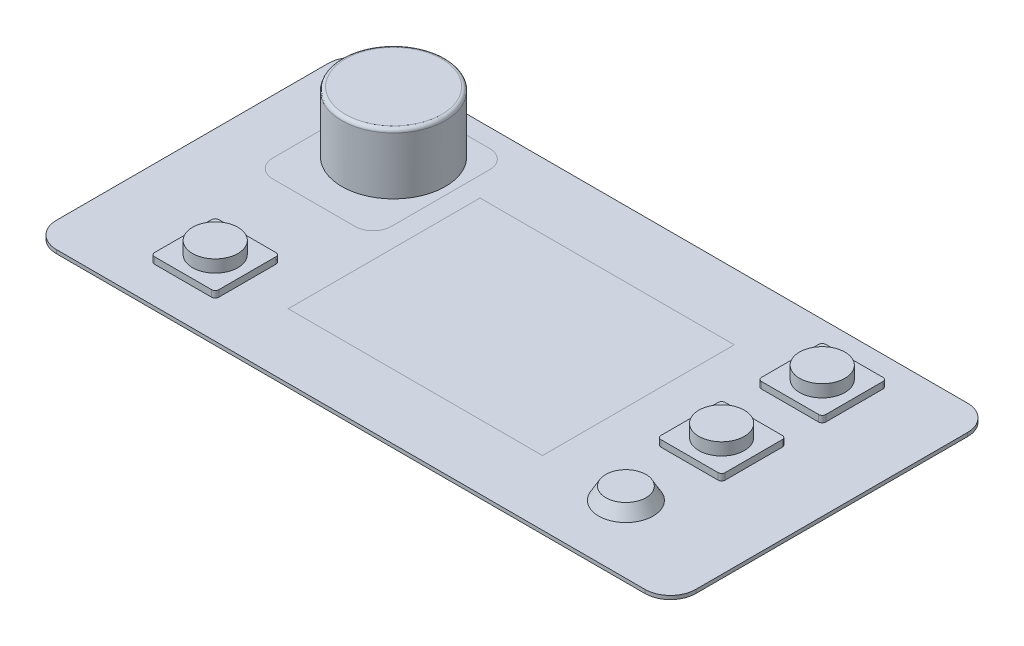
from build123d import *

# Parameters (mm, degrees)
SKETCH1_W           = 176
SKETCH1_H           = 88.8
BOSS_EXTRUDE1_DEPTH = 1
SKETCH2_R           = 14.25
BOSS_EXTRUDE2_DEPTH = 16.7
FILLET1_R           = 1
SKETCH3_W           = 17.7
SKETCH3_H           = 17.7
BOSS_EXTRUDE3_DEPTH = 1.8
FILLET2_R           = 1
FILLET3_R           = 7
SKETCH4_R           = 6.25
BOSS_EXTRUDE4_DEPTH = 3.4
SKETCH7_R           = 7.5
BOSS_EXTRUDE5_DEPTH = 3.4
BOSS_EXTRUDE5_TAPER = 30


with BuildPart() as part:
    # Sketch1 → Boss-Extrude1 (new body)
    with BuildSketch(Plane(origin=(0, 0, 0), x_dir=(1, 0, 0), z_dir=(0, 1, 0))):
        Rectangle(SKETCH1_W, SKETCH1_H)
    extrude(amount=BOSS_EXTRUDE1_DEPTH)

    # Sketch2 → Boss-Extrude2 (add)
    with BuildSketch(Plane(origin=(0, 1, 0), x_dir=(1, 0, 0), z_dir=(0, 1, 0))):
        with Locations(Location((-56.75, 24.15, 0), (0, 0, 90))):
            Circle(SKETCH2_R)
    extrude(amount=BOSS_EXTRUDE2_DEPTH)

    # Fillet1
    fillet1_edges = [part.edges().sort_by_distance(p)[0] for p in [
        (-56.75, 17.7, -9.9),
    ]]
    fillet(fillet1_edges, radius=FILLET1_R)

    # Sketch3 → Boss-Extrude3 (add)
    with BuildSketch(Plane(origin=(0, 1, 0), x_dir=(1, 0, 0), z_dir=(0, 1, 0))):
        with Locations((-56.15, -25.55)):
            Rectangle(SKETCH3_W, SKETCH3_H)
        with Locations((57.15, 28.25)):
            Rectangle(SKETCH3_W, SKETCH3_H)
        with Locations((57.15, 0.55)):
            Rectangle(SKETCH3_W, SKETCH3_H)
    extrude(amount=BOSS_EXTRUDE3_DEPTH)

    # Fillet2
    fillet2_edges = [part.edges().sort_by_distance(p)[0] for p in [
        (-47.3, 1.9, 34.4),
        (-47.3, 1.9, 16.7),
        (-65, 1.9, 16.7),
        (-65, 1.9, 34.4),
        (66, 1.9, -19.4),
        (66, 1.9, -37.1),
        (48.3, 1.9, -37.1),
        (48.3, 1.9, -19.4),
        (66, 1.9, 8.3),
        (66, 1.9, -9.4),
        (48.3, 1.9, -9.4),
        (48.3, 1.9, 8.3),
    ]]
    fillet(fillet2_edges, radius=FILLET2_R)

    # Fillet3
    fillet3_edges = [part.edges().sort_by_distance(p)[0] for p in [
        (88, 0.5, 44.4),
        (-88, 0.5, 44.4),
        (-88, 0.5, -44.4),
        (88, 0.5, -44.4),
    ]]
    fillet(fillet3_edges, radius=FILLET3_R)

    # Sketch4 → Boss-Extrude4 (add)
    with BuildSketch(Plane(origin=(0, 2.8, 0), x_dir=(1, 0, 0), z_dir=(0, 1, 0))):
        with Locations(Location((-56.15, -25.55, 0), (0, 0, 90))):
            Circle(SKETCH4_R)
        with Locations(Location((57.15, 28.25, 0), (0, 0, 90))):
            Circle(SKETCH4_R)
        with Locations(Location((57.15, 0.55, 0), (0, 0, 90))):
            Circle(SKETCH4_R)
    extrude(amount=BOSS_EXTRUDE4_DEPTH)

    # Sketch7 → Boss-Extrude5 (add)
    with BuildSketch(Plane(origin=(0, 1, 0), x_dir=(1, 0, 0), z_dir=(0, 1, 0))):
        with Locations((57.15, -25.8)):
            Circle(SKETCH7_R)
    extrude(amount=BOSS_EXTRUDE5_DEPTH, taper=BOSS_EXTRUDE5_TAPER)


solid = part.part
